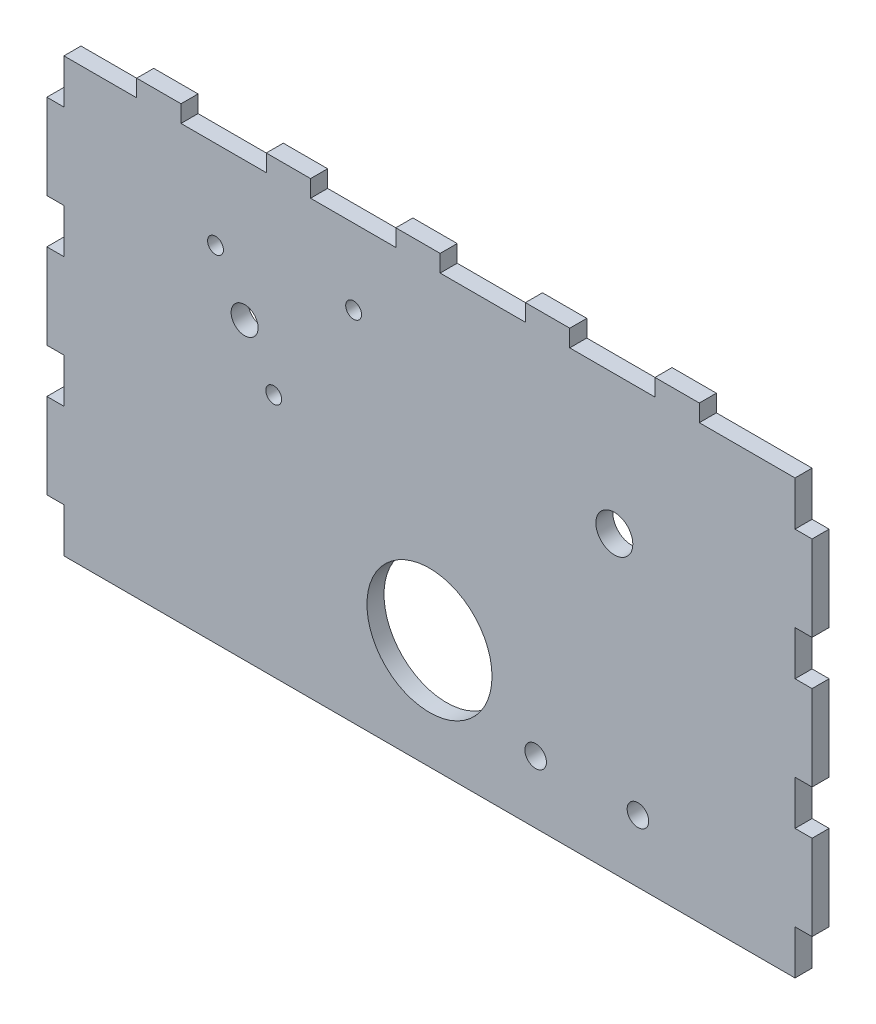
from build123d import *

# Parameters (mm, degrees)
MODEL_R             = 1.397
MODEL_R_2           = 1.89865
MODEL_R_3           = 3.25
MODEL_R_4           = 2.3749
MODEL_R_5           = 11
BOSS_EXTRUDE1_DEPTH = 3


with BuildPart() as part:
    # Model → Boss-Extrude1 (new body)
    with BuildSketch(Plane.XY):
        Polygon((67.32, 30.3), (64.32, 30.3), (64.32, 38.1), (47.48, 38.1), (47.48, 41.1), (39.68, 41.1), (39.68, 38.1), (24.68, 38.1), (24.68, 41.1), (16.88, 41.1), (16.88, 38.1), (1.88, 38.1), (1.88, 41.1), (-5.92, 41.1), (-5.92, 38.1), (-20.92, 38.1), (-20.92, 41.1), (-28.72, 41.1), (-28.72, 38.1), (-43.72, 38.1), (-43.72, 41.1), (-51.52, 41.1), (-51.52, 38.1), (-64.32, 38.1), (-64.32, 30.3), (-67.32, 30.3), (-67.32, 15.3), (-64.32, 15.3), (-64.32, 7.5), (-67.32, 7.5), (-67.32, -7.5), (-64.32, -7.5), (-64.32, -15.3), (-67.32, -15.3), (-67.32, -30.3), (-64.32, -30.3), (-64.32, -38.1), (64.32, -38.1), (64.32, -30.3), (67.32, -30.3), (67.32, -15.3), (64.32, -15.3), (64.32, -7.5), (67.32, -7.5), (67.32, 7.5), (64.32, 7.5), (64.32, 15.3), (67.32, 15.3), align=None)
        with Locations((-37.648489217, 22.560364418)):
            Circle(MODEL_R, mode=Mode.SUBTRACT)
        with Locations((-27.405334652, 4.893459451)):
            Circle(MODEL_R, mode=Mode.SUBTRACT)
        with Locations((-13.343817362, 24.849143198)):
            Circle(MODEL_R, mode=Mode.SUBTRACT)
        with Locations((36.68, -27.1)):
            Circle(MODEL_R_2, mode=Mode.SUBTRACT)
        with Locations((18.68, -27.1)):
            Circle(MODEL_R_2, mode=Mode.SUBTRACT)
        with Locations((32.526911935, 13.726911935)):
            Circle(MODEL_R_3, mode=Mode.SUBTRACT)
        with Locations((-32.526911935, 13.726911935)):
            Circle(MODEL_R_4, mode=Mode.SUBTRACT)
        with Locations((0, -18.8)):
            Circle(MODEL_R_5, mode=Mode.SUBTRACT)
    extrude(amount=BOSS_EXTRUDE1_DEPTH)


solid = part.part
